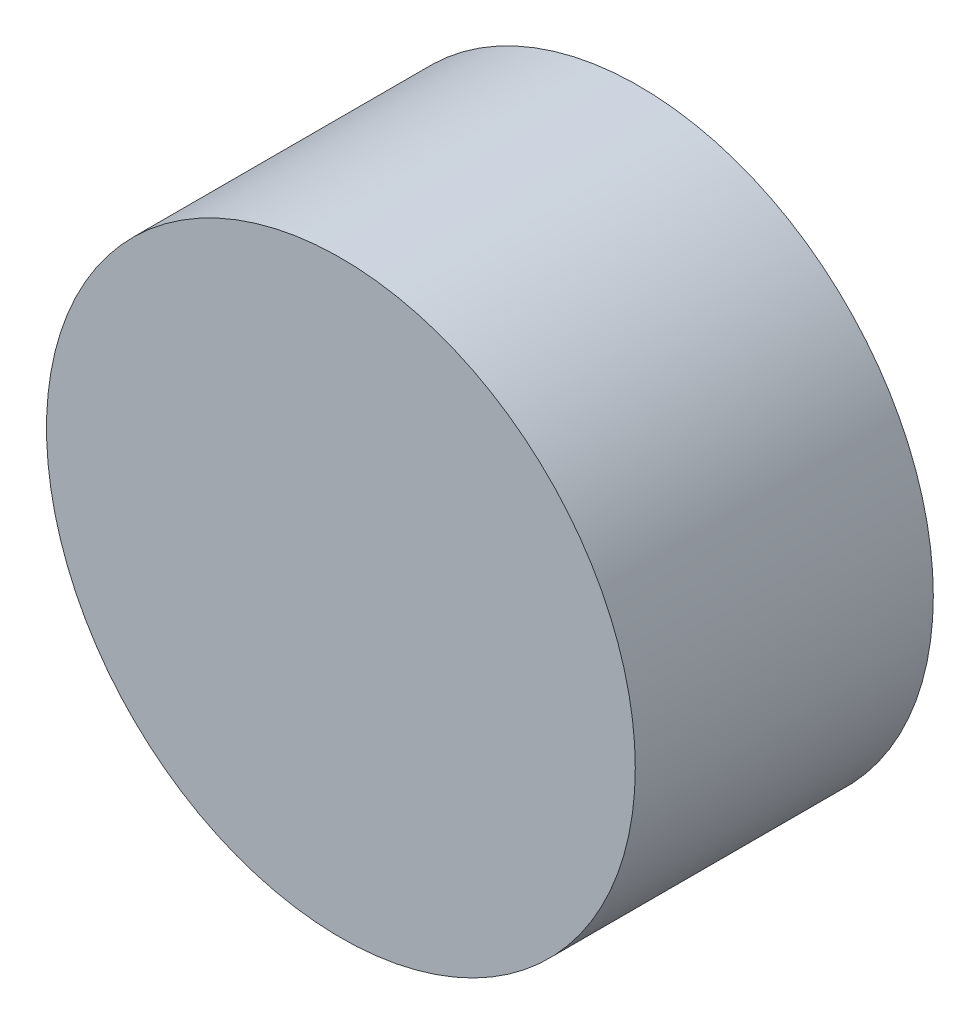
from build123d import *

# Parameters (mm, degrees)
SKETCH1_R           = 10
BOSS_EXTRUDE1_DEPTH = 10.123456789


with BuildPart() as part:
    # Sketch1 → Boss-Extrude1 (new body)
    with BuildSketch(Plane.XY):
        Circle(SKETCH1_R)
    extrude(amount=BOSS_EXTRUDE1_DEPTH)


solid = part.part
